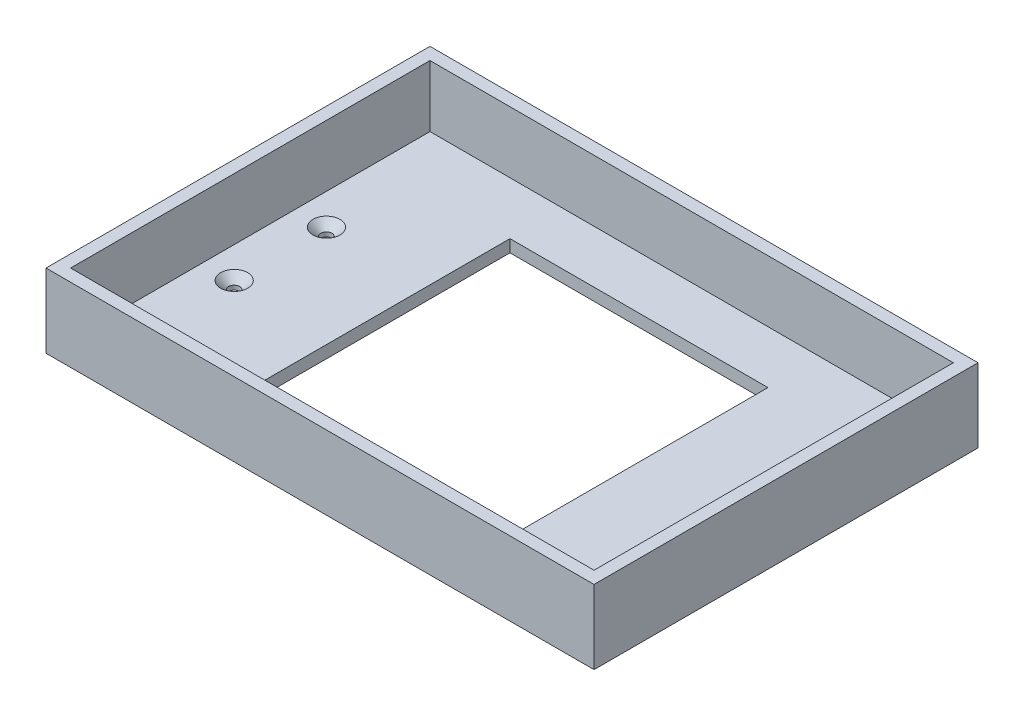
from build123d import *

# Parameters (mm, degrees)
SKETCH1_W                                       = 89.09
SKETCH1_H                                       = 62.42
BOSS_EXTRUDE1_DEPTH                             = 2
SKETCH1_3_W                                     = 89.09
SKETCH1_3_H                                     = 62.42
SKETCH1_3_W_2                                   = 85.09
SKETCH1_3_H_2                                   = 58.42
BOSS_EXTRUDE2_DEPTH                             = 10
CSK_FOR_M2_FLAT_HEAD_MACHINE_SCREW1_D           = 1.8
CSK_FOR_M2_FLAT_HEAD_MACHINE_SCREW1_DEPTH       = 9.906
CSK_FOR_M2_FLAT_HEAD_MACHINE_SCREW1_CSINK_D     = 4.4
CSK_FOR_M2_FLAT_HEAD_MACHINE_SCREW1_CSINK_ANGLE = 90
CSK_FOR_M2_FLAT_HEAD_MACHINE_SCREW1_TIP         = 0.540774557
SKETCH7_W                                       = 41.935160688
SKETCH7_H                                       = 41.279429724
CUT_EXTRUDE1_DEPTH                              = 2.54


with BuildPart() as part:
    # Sketch1 → Boss-Extrude1 (new body)
    with BuildSketch(Plane(origin=(0, 0, 0), x_dir=(1, 0, 0), z_dir=(0, 1, 0))):
        Rectangle(SKETCH1_W, SKETCH1_H)
    extrude(amount=-BOSS_EXTRUDE1_DEPTH)

    # Sketch1<3> → Boss-Extrude2 (add)
    with BuildSketch(Plane(origin=(0, 0, 0), x_dir=(1, 0, 0), z_dir=(0, 1, 0))):
        Rectangle(SKETCH1_3_W, SKETCH1_3_H)
        Rectangle(SKETCH1_3_W_2, SKETCH1_3_H_2, mode=Mode.SUBTRACT)
    extrude(amount=BOSS_EXTRUDE2_DEPTH)

    # CSK for M2 Flat Head Machine Screw1
    with Locations(Plane(origin=(0, 0, 0), x_dir=(1, 0, 0), z_dir=(0, 1, 0))):
        with Locations((37.5, 7.335501447), (-37.5, 7.335501447), (-37.5, -7.664498553), (37.5, -7.664498553)):
            CounterSinkHole(CSK_FOR_M2_FLAT_HEAD_MACHINE_SCREW1_D / 2, CSK_FOR_M2_FLAT_HEAD_MACHINE_SCREW1_CSINK_D / 2, depth=CSK_FOR_M2_FLAT_HEAD_MACHINE_SCREW1_DEPTH, counter_sink_angle=CSK_FOR_M2_FLAT_HEAD_MACHINE_SCREW1_CSINK_ANGLE)
            with Locations((0, 0, -(CSK_FOR_M2_FLAT_HEAD_MACHINE_SCREW1_DEPTH + CSK_FOR_M2_FLAT_HEAD_MACHINE_SCREW1_TIP / 2))):  # 118° drill point
                Cone(0, CSK_FOR_M2_FLAT_HEAD_MACHINE_SCREW1_D / 2, CSK_FOR_M2_FLAT_HEAD_MACHINE_SCREW1_TIP, mode=Mode.SUBTRACT)

    # Sketch7 → Cut-Extrude1 (cut)
    with BuildSketch(Plane(origin=(0, 0, 0), x_dir=(1, 0, 0), z_dir=(0, 1, 0))):
        Rectangle(SKETCH7_W, SKETCH7_H)
    extrude(amount=-CUT_EXTRUDE1_DEPTH, mode=Mode.SUBTRACT)


solid = part.part
